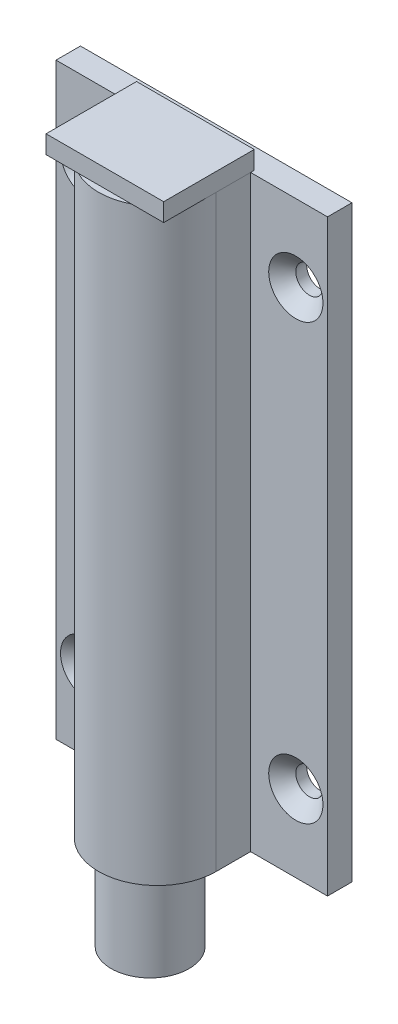
from build123d import *

# Parameters (mm, degrees)
SKETCH_1_W      = 30
SKETCH_1_H      = 65
SKETCH_1_R      = 1.5
EXTRUDE_1_DEPTH = 2.7
SKETCH_2_R      = 4.3
EXTRUDE_2_DEPTH = 65
SKETCH_3_R      = 4.3
EXTRUDE_3_DEPTH = 10
SKETCH_4_W      = 13
SKETCH_4_H      = 10
EXTRUDE_4_DEPTH = 2
CHAMFER_1_SIZE  = 1.5


with BuildPart() as part:
    # 草图1 → 凸台-拉伸1 (new body)
    with BuildSketch(Plane.XY):
        Rectangle(SKETCH_1_W, SKETCH_1_H)
        with Locations(Location((-11.5, 24, 0), (0, 0, 180))):
            Circle(SKETCH_1_R, mode=Mode.SUBTRACT)
        with Locations(Location((11.5, 24, 0), (0, 0, 180))):
            Circle(SKETCH_1_R, mode=Mode.SUBTRACT)
        with Locations(Location((11.5, -24, 0), (0, 0, 180))):
            Circle(SKETCH_1_R, mode=Mode.SUBTRACT)
        with Locations(Location((-11.5, -24, 0), (0, 0, 180))):
            Circle(SKETCH_1_R, mode=Mode.SUBTRACT)
    extrude(amount=EXTRUDE_1_DEPTH)

    # 草图2 → 凸台-拉伸2 (add)
    with BuildSketch(Plane.XZ.offset(32.5)):
        with BuildLine():
            Line((-6.5, 2.7), (-6.5, 6.5))
            ThreePointArc((-6.5, 6.5), (0, 13), (6.5, 6.5))
            Line((6.5, 6.5), (6.5, 2.7))
            Line((6.5, 2.7), (-6.5, 2.7))
        make_face()
        with Locations(Location((0, 7.3, 0), (0, 0, 270))):
            Circle(SKETCH_2_R, mode=Mode.SUBTRACT)
    extrude(amount=-EXTRUDE_2_DEPTH)

    # 倒角1
    chamfer_1_edges = [part.edges().sort_by_distance(p)[0] for p in [
        (-10, 24, 2.7),
        (13, 24, 2.7),
        (13, -24, 2.7),
        (-10, -24, 2.7),
    ]]
    chamfer(chamfer_1_edges, length=CHAMFER_1_SIZE)


with BuildPart() as body_2:
    # 草图3 → 凸台-拉伸3 (new body)
    with BuildSketch(Plane.XZ.offset(32.5)):
        with Locations(Location((0, 7.3, 0), (0, 0, 270))):
            Circle(SKETCH_3_R)
    extrude(amount=EXTRUDE_3_DEPTH)


with BuildPart() as body_3:
    # 草图4 → 凸台-拉伸4 (new body)
    with BuildSketch(Plane(origin=(0, 32.5, 0), x_dir=(1, 0, 0), z_dir=(0, 1, 0))):
        with Locations((0, -7.3)):
            Rectangle(SKETCH_4_W, SKETCH_4_H)
    extrude(amount=EXTRUDE_4_DEPTH)


solid = Compound([part.part, body_2.part, body_3.part])
